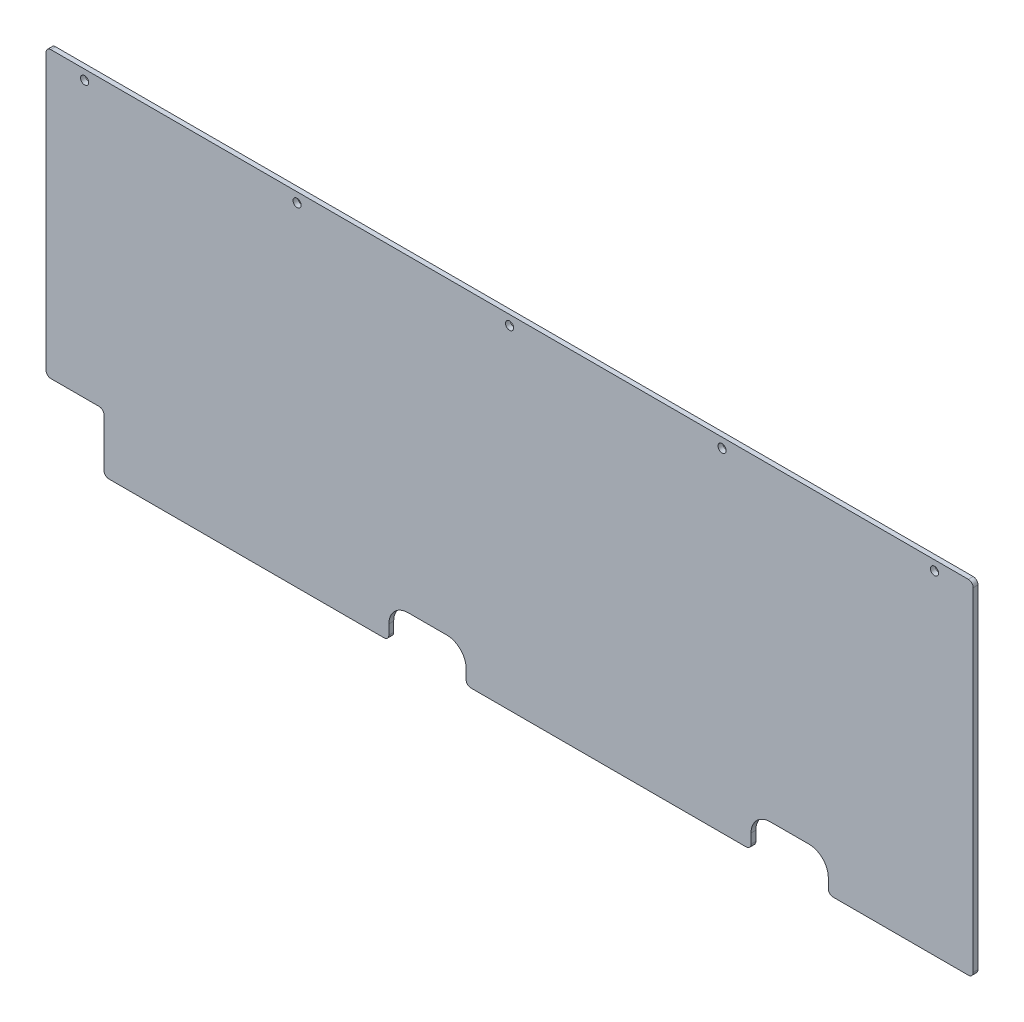
from build123d import *

# Parameters (mm, degrees)
SKETCH1_W                        = 1219.2
SKETCH1_H                        = 450.85
BOSS_EXTRUDE1_DEPTH              = 6.35
CUT_EXTRUDE1_DEPTH               = 1300.905644653
LPATTERN1_COUNT                  = 2
LPATTERN1_PITCH                  = 476.25
SKETCH3_W                        = 76.2
SKETCH3_H                        = 76.2
CUT_EXTRUDE2_DEPTH               = 1300.905644653
FILLET1_R                        = 6.35
F_27_64_0_42188_DIAMETER_HOLE1_D = 10.715752
FILLET2_R                        = 6.35


with BuildPart() as part:
    # Sketch1 → Boss-Extrude1 (new body)
    with BuildSketch(Plane.XY):
        with Locations((609.6, 225.425)):
            Rectangle(SKETCH1_W, SKETCH1_H)
    extrude(amount=BOSS_EXTRUDE1_DEPTH)

    # Sketch2 → Cut-Extrude1 (cut, through all)
    with BuildSketch(Plane.XY.offset(6.35)):
        with BuildLine():
            Line((450.85, 19.05), (450.85, 0))
            Line((450.85, 0), (552.45, 0))
            Line((552.45, 0), (552.45, 19.05))
            ThreePointArc((552.45, 19.05), (545.010512242, 37.010512242), (527.05, 44.45))
            Line((527.05, 44.45), (476.25, 44.45))
            ThreePointArc((476.25, 44.45), (458.289487758, 37.010512242), (450.85, 19.05))
        make_face()
    cut_extrude1 = extrude(amount=-CUT_EXTRUDE1_DEPTH, mode=Mode.SUBTRACT)

    # LPattern1: Cut-Extrude1 ×2
    with Locations(*[(i * LPATTERN1_PITCH, 0, 0) for i in range(1, LPATTERN1_COUNT)]):
        add(cut_extrude1, mode=Mode.SUBTRACT)

    # Sketch3 → Cut-Extrude2 (cut, through all)
    with BuildSketch(Plane.XY.offset(6.35)):
        with Locations((38.1, 38.1)):
            Rectangle(SKETCH3_W, SKETCH3_H)
    extrude(amount=-CUT_EXTRUDE2_DEPTH, mode=Mode.SUBTRACT)

    # Fillet1
    fillet1_edges = [part.edges().sort_by_distance(p)[0] for p in [
        (76.2, 76.2, 3.175),
    ]]
    fillet(fillet1_edges, radius=FILLET1_R)

    # 27/64 (0.42188) Diameter Hole1 (through all)
    with Locations(Plane.XY.offset(6.35)):
        with Locations((50.8, 438.15), (330.2, 438.15), (609.6, 438.15), (889, 438.15), (1168.4, 438.15)):
            Hole(F_27_64_0_42188_DIAMETER_HOLE1_D / 2)

    # Fillet2
    fillet2_edges = [part.edges().sort_by_distance(p)[0] for p in [
        (552.45, 0, 3.175),
        (450.85, 0, 3.175),
        (1028.7, 0, 3.175),
        (927.1, 0, 3.175),
        (0, 76.2, 3.175),
        (76.2, 0, 3.175),
        (0, 450.85, 3.175),
        (1219.2, 450.85, 3.175),
        (1219.2, 0, 3.175),
    ]]
    fillet(fillet2_edges, radius=FILLET2_R)


solid = part.part
